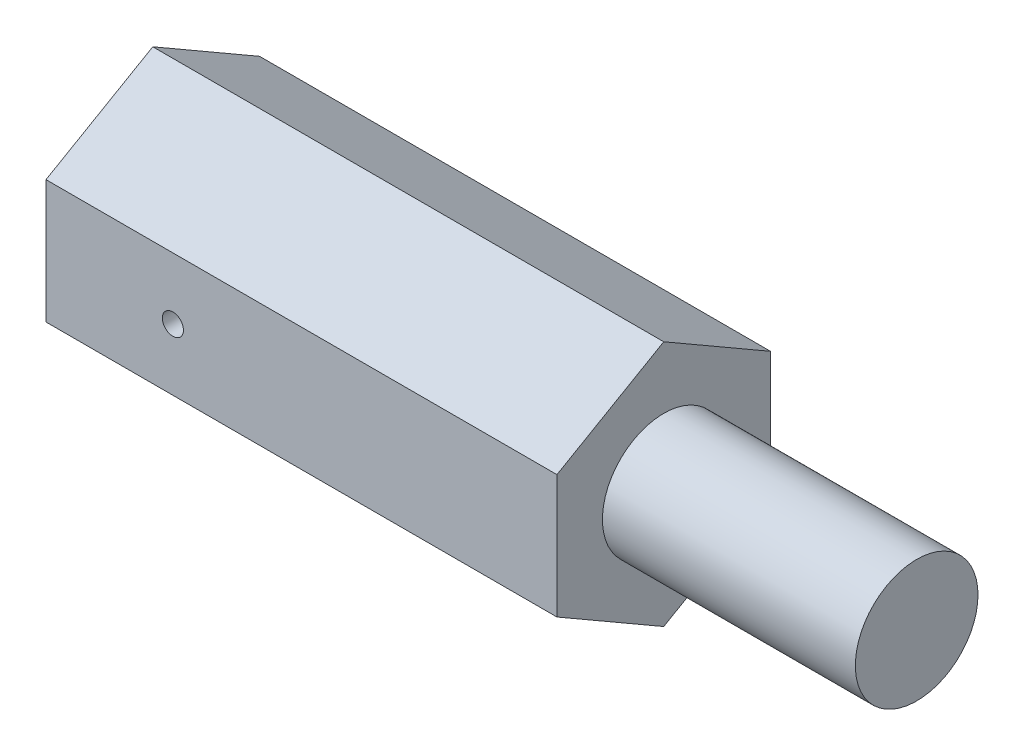
from build123d import *

# Parameters (mm, degrees)
ESTRUSIONE_ESTRUSIONE1_DEPTH        = 12.08
SCHIZZO2_R                          = 1.45
ESTRUSIONE_ESTRUSIONE2_DEPTH        = 5.98
FORO_FILETTATO_M3X0_5_1_D           = 2.5
FORO_FILETTATO_M3X0_5_1_DEPTH       = 8
FORO_FILETTATO_M3X0_5_1_CSINK_D     = 4
FORO_FILETTATO_M3X0_5_1_CSINK_ANGLE = 90
FORO_FILETTATO_M3X0_5_1_TIP         = 0.751075774
TAGLIO_ESTRUSIONE1_REACH            = 20.978
TAGLIO_ESTRUSIONE1_END_RADIUS       = 1.25
SCHIZZO5_R                          = 0.25
TAGLIO_ESTRUSIONE2_REACH            = 20.978
TAGLIO_ESTRUSIONE2_END_RADIUS       = 1.25
SCHIZZO6_R                          = 1


with BuildPart() as part:
    # Schizzo1 → Estrusione-Estrusione1 (new body)
    with BuildSketch(Plane(origin=(0, 0, 0), x_dir=(0, 0, -1), z_dir=(1, 0, 0))):
        Polygon((0, 2.915618859), (-2.525, 1.45780943), (-2.525, -1.45780943), (0, -2.915618859), (2.525, -1.45780943), (2.525, 1.45780943), align=None)
    extrude(amount=ESTRUSIONE_ESTRUSIONE1_DEPTH)

    # Schizzo2 → Estrusione-Estrusione2 (add)
    with BuildSketch(Plane(origin=(12.08, 0, 0), x_dir=(0, 0, -1), z_dir=(1, 0, 0))):
        Circle(SCHIZZO2_R)
    extrude(amount=ESTRUSIONE_ESTRUSIONE2_DEPTH)

    # Foro filettato M3x0.5-1
    with Locations(Plane.ZY):
        with Locations((0, 0)):
            CounterSinkHole(FORO_FILETTATO_M3X0_5_1_D / 2, FORO_FILETTATO_M3X0_5_1_CSINK_D / 2, depth=FORO_FILETTATO_M3X0_5_1_DEPTH, counter_sink_angle=FORO_FILETTATO_M3X0_5_1_CSINK_ANGLE)
            with Locations((0, 0, -(FORO_FILETTATO_M3X0_5_1_DEPTH + FORO_FILETTATO_M3X0_5_1_TIP / 2))):  # 118° drill point
                Cone(0, FORO_FILETTATO_M3X0_5_1_D / 2, FORO_FILETTATO_M3X0_5_1_TIP, mode=Mode.SUBTRACT)

    # Taglio-Estrusione1: up to this cylinder (the profile starts outside it)
    taglio_estrusione1_end = Plane(origin=(3, 0, 0), z_dir=(-1, 0, 0)) * Cylinder(TAGLIO_ESTRUSIONE1_END_RADIUS, 45.456, mode=Mode.PRIVATE)
    # Schizzo5 → Taglio-Estrusione1 (cut, up to the surface)
    with BuildSketch(Plane.XY.offset(2.525), mode=Mode.PRIVATE) as taglio_estrusione1_sk1:
        with Locations((3, 0)):
            Circle(SCHIZZO5_R)
    taglio_estrusione1_tool1 = extrude(taglio_estrusione1_sk1.sketch, amount=-TAGLIO_ESTRUSIONE1_REACH, mode=Mode.PRIVATE) - taglio_estrusione1_end
    add(taglio_estrusione1_tool1.solids().sort_by_distance((3, 0, 2.525))[0], mode=Mode.SUBTRACT)

    # Taglio-Estrusione2: up to this cylinder (the profile starts outside it)
    taglio_estrusione2_end = Plane(origin=(3, 0, 0), z_dir=(-1, 0, 0)) * Cylinder(TAGLIO_ESTRUSIONE2_END_RADIUS, 45.456, mode=Mode.PRIVATE)
    # Schizzo6 → Taglio-Estrusione2 (cut, up to the surface)
    with BuildSketch(Plane(origin=(0, 0, -2.525), x_dir=(-1, 0, 0), z_dir=(0, 0, -1)), mode=Mode.PRIVATE) as taglio_estrusione2_sk1:
        with Locations(Location((-3, 0, 0), (0, 0, 90))):
            Circle(SCHIZZO6_R)
    taglio_estrusione2_tool1 = extrude(taglio_estrusione2_sk1.sketch, amount=-TAGLIO_ESTRUSIONE2_REACH, mode=Mode.PRIVATE) - taglio_estrusione2_end
    add(taglio_estrusione2_tool1.solids().sort_by_distance((3, 0, -2.525))[0], mode=Mode.SUBTRACT)


solid = part.part
